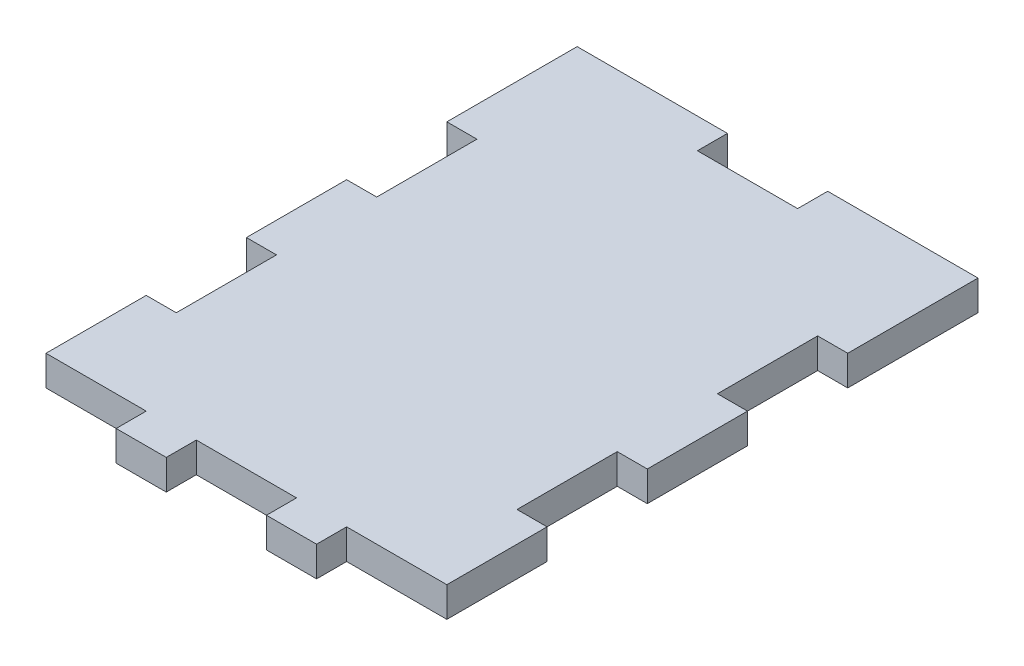
from build123d import *

# Parameters (mm, degrees)
RESSALTO_EXTRUS_O1_DEPTH = 6


with BuildPart() as part:
    # Esboço1 → Ressalto-extrusão1 (new body)
    with BuildSketch(Plane(origin=(0, 0, 0), x_dir=(1, 0, 0), z_dir=(0, 1, 0))):
        Polygon((-80, 80), (-74, 80), (-74, 60), (-80, 60), (-80, 40), (-74, 40), (-74, 20), (-80, 20), (-80, 0), (-60, 0), (-60, -6), (-50, -6), (-50, 0), (-30, 0), (-30, -6), (-20, -6), (-20, 0), (0, 0), (0, 20), (-6, 20), (-6, 40), (0, 40), (0, 60), (-6, 60), (-6, 80), (0, 80), (0, 106), (-30, 106), (-30, 100), (-50, 100), (-50, 106), (-80, 106), align=None)
    extrude(amount=RESSALTO_EXTRUS_O1_DEPTH)


solid = part.part
